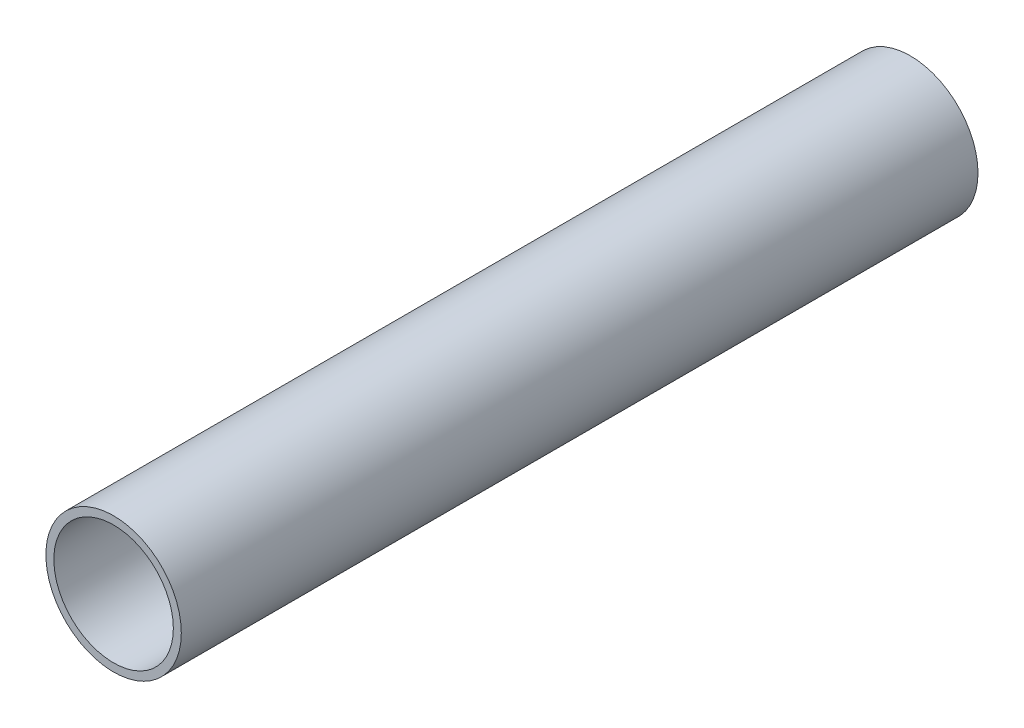
from build123d import *

# Parameters (mm, degrees)
SKETCH1_R           = 17
SKETCH1_R_2         = 15
BOSS_EXTRUDE1_DEPTH = 100


with BuildPart() as part:
    # Sketch1 → Boss-Extrude1 (new, symmetric)
    with BuildSketch(Plane.XY):
        Circle(SKETCH1_R)
        Circle(SKETCH1_R_2, mode=Mode.SUBTRACT)
    extrude(amount=BOSS_EXTRUDE1_DEPTH, both=True)


solid = part.part
